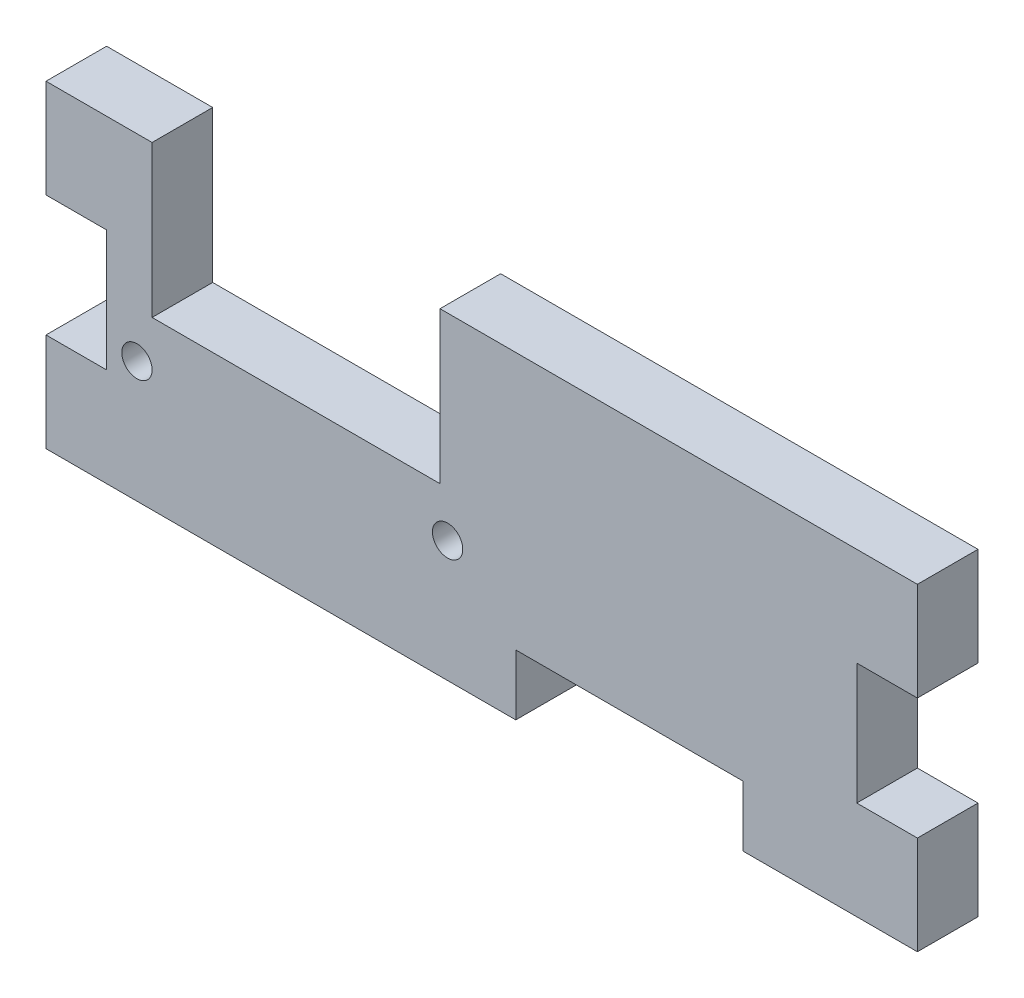
from build123d import *

# Parameters (mm, degrees)
SKETCH_1_R          = 1
EXTRUDE_1_DEPTH     = 4
SKETCH_2_W          = 15
SKETCH_2_H          = 4
CUT_EXTRUDE_1_DEPTH = 10
SKETCH_3_W          = 4
SKETCH_3_H          = 6.5
EXTRUDE_2_DEPTH     = 4


with BuildPart() as part:
    # Эскиз1 → Бобышка-Вытянуть1 (new body)
    with BuildSketch(Plane.XY):
        Polygon((0, 0), (0, 15), (3, 15), (3, 5), (22, 5), (22, 15), (49.5, 15), (49.5, -6), (0, -6), align=None)
        with Locations((22.5, 2)):
            Circle(SKETCH_1_R, mode=Mode.SUBTRACT)
        with Locations(Location((2, 2, 0), (0, 0, 180))):
            Circle(SKETCH_1_R, mode=Mode.SUBTRACT)
    extrude(amount=EXTRUDE_1_DEPTH)

    # Эскиз2 → Вырез-Вытянуть1 (cut)
    with BuildSketch(Plane.XY.offset(4)):
        with Locations((34.5, -4)):
            Rectangle(SKETCH_2_W, SKETCH_2_H)
    extrude(amount=-CUT_EXTRUDE_1_DEPTH, mode=Mode.SUBTRACT)

    # Эскиз3 → Бобышка-Вытянуть2 (add)
    with BuildSketch(Plane.XY.offset(4)):
        with Locations((-2, -2.75)):
            Rectangle(SKETCH_3_W, SKETCH_3_H)
        with Locations((-2, 11.75)):
            Rectangle(SKETCH_3_W, SKETCH_3_H)
        with Locations((51.5, 11.75)):
            Rectangle(SKETCH_3_W, SKETCH_3_H)
        with Locations((51.5, -2.75)):
            Rectangle(SKETCH_3_W, SKETCH_3_H)
    extrude(amount=-EXTRUDE_2_DEPTH)


solid = part.part
